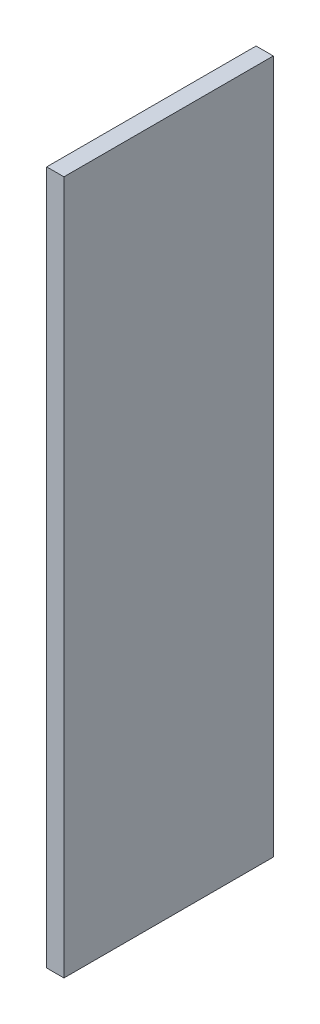
from build123d import *

# Parameters (mm, degrees)
SKETCH1_W           = 222.25
SKETCH1_H           = 736.6
BOSS_EXTRUDE1_DEPTH = 18.288


with BuildPart() as part:
    # Sketch1 → Boss-Extrude1 (new body)
    with BuildSketch(Plane(origin=(0, 0, 0), x_dir=(0, 0, -1), z_dir=(1, 0, 0))):
        Rectangle(SKETCH1_W, SKETCH1_H)
    extrude(amount=BOSS_EXTRUDE1_DEPTH)


solid = part.part
